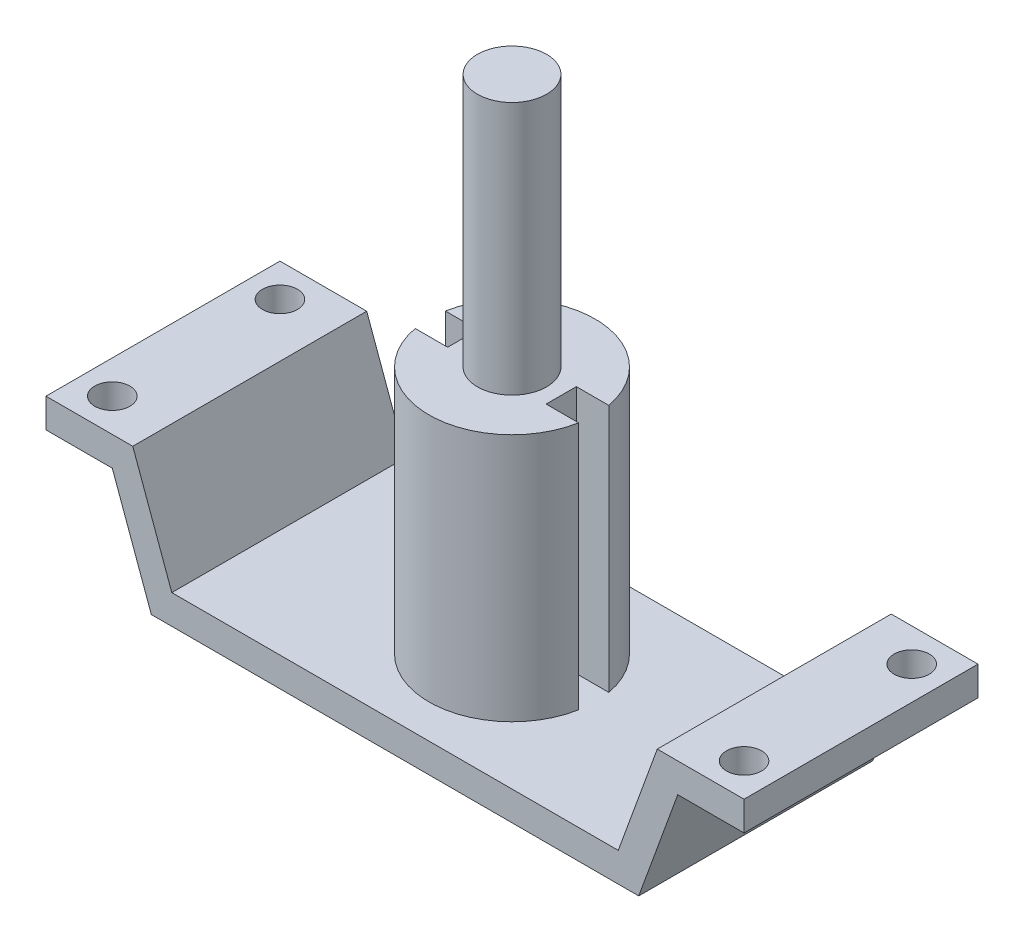
from build123d import *

# Parameters (mm, degrees)
SKETCH1_W           = 50
SKETCH1_H           = 24
BOSS_EXTRUDE1_DEPTH = 3
BOSS_EXTRUDE2_DEPTH = 24
SKETCH3_R           = 8.525
BOSS_EXTRUDE3_DEPTH = 25.5
SKETCH4_R           = 3.55
BOSS_EXTRUDE4_DEPTH = 26
SKETCH5_W           = 4
SKETCH5_H           = 3.1
CUT_EXTRUDE1_DEPTH  = 25.5
CUT_EXTRUDE2_REACH  = 57.373
SKETCH6_R           = 1.8


with BuildPart() as part:
    # Sketch1 → Boss-Extrude1 (new body)
    with BuildSketch(Plane(origin=(0, 0, 0), x_dir=(1, 0, 0), z_dir=(0, 1, 0))):
        Rectangle(SKETCH1_W, SKETCH1_H)
    extrude(amount=BOSS_EXTRUDE1_DEPTH)

    # Sketch2 → Boss-Extrude2 (add)
    with BuildSketch(Plane.XY.offset(12)):
        Polygon((-25, 0), (-29.003672577, 11), (-35.803672577, 11), (-35.803672577, 14), (-26.903049962, 14), (-22.899377385, 3), align=None)
        Polygon((25, 0), (29.003672577, 11), (35.803672577, 11), (35.803672577, 14), (26.903049962, 14), (22.899377385, 3), align=None)
    extrude(amount=-BOSS_EXTRUDE2_DEPTH)

    # Sketch3 → Boss-Extrude3 (add)
    with BuildSketch(Plane(origin=(0, 3, 0), x_dir=(1, 0, 0), z_dir=(0, 1, 0))):
        with Locations(Location((0, 0, 0), (0, 0, 270))):
            Circle(SKETCH3_R)
    extrude(amount=BOSS_EXTRUDE3_DEPTH)

    # Sketch4 → Boss-Extrude4 (add)
    with BuildSketch(Plane(origin=(0, 28.5, 0), x_dir=(1, 0, 0), z_dir=(0, 1, 0))):
        with Locations(Location((0, 0, 0), (0, 0, 90))):
            Circle(SKETCH4_R)
    extrude(amount=BOSS_EXTRUDE4_DEPTH)

    # Sketch5 → Cut-Extrude1 (cut)
    with BuildSketch(Plane(origin=(0, 28.5, 0), x_dir=(1, 0, 0), z_dir=(0, 1, 0))):
        with Locations((-7.05, 0)):
            Rectangle(SKETCH5_W, SKETCH5_H)
        with Locations((7.05, 0)):
            Rectangle(SKETCH5_W, SKETCH5_H)
    extrude(amount=-CUT_EXTRUDE1_DEPTH, mode=Mode.SUBTRACT)

    # Sketch6 → Cut-Extrude2 (cut, up to next)
    with BuildSketch(Plane(origin=(0, 14, 0), x_dir=(1, 0, 0), z_dir=(0, 1, 0)), mode=Mode.PRIVATE) as cut_extrude2_sk1:
        with Locations(Location((-32.403672577, 8.6, 0), (0, 0, 270))):
            Circle(SKETCH6_R)
    cut_extrude2_tool1 = extrude(cut_extrude2_sk1.sketch, amount=-CUT_EXTRUDE2_REACH, mode=Mode.PRIVATE) & part.part
    # Sketch6 → Cut-Extrude2 (cut, up to next)
    with BuildSketch(Plane(origin=(0, 14, 0), x_dir=(1, 0, 0), z_dir=(0, 1, 0)), mode=Mode.PRIVATE) as cut_extrude2_sk2:
        with Locations((-32.403672577, -8.6)):
            Circle(SKETCH6_R)
    cut_extrude2_tool2 = extrude(cut_extrude2_sk2.sketch, amount=-CUT_EXTRUDE2_REACH, mode=Mode.PRIVATE) & part.part
    # Sketch6 → Cut-Extrude2 (cut, up to next)
    with BuildSketch(Plane(origin=(0, 14, 0), x_dir=(1, 0, 0), z_dir=(0, 1, 0)), mode=Mode.PRIVATE) as cut_extrude2_sk3:
        with Locations(Location((32.403672577, -8.6, 0), (0, 0, 270))):
            Circle(SKETCH6_R)
    cut_extrude2_tool3 = extrude(cut_extrude2_sk3.sketch, amount=-CUT_EXTRUDE2_REACH, mode=Mode.PRIVATE) & part.part
    # Sketch6 → Cut-Extrude2 (cut, up to next)
    with BuildSketch(Plane(origin=(0, 14, 0), x_dir=(1, 0, 0), z_dir=(0, 1, 0)), mode=Mode.PRIVATE) as cut_extrude2_sk4:
        with Locations((32.403672577, 8.6)):
            Circle(SKETCH6_R)
    cut_extrude2_tool4 = extrude(cut_extrude2_sk4.sketch, amount=-CUT_EXTRUDE2_REACH, mode=Mode.PRIVATE) & part.part
    add(cut_extrude2_tool1.solids().sort_by_distance((-32.403673, 14, -8.6))[0], mode=Mode.SUBTRACT)
    add(cut_extrude2_tool2.solids().sort_by_distance((-32.403673, 14, 8.6))[0], mode=Mode.SUBTRACT)
    add(cut_extrude2_tool3.solids().sort_by_distance((32.403673, 14, 8.6))[0], mode=Mode.SUBTRACT)
    add(cut_extrude2_tool4.solids().sort_by_distance((32.403673, 14, -8.6))[0], mode=Mode.SUBTRACT)


solid = part.part
